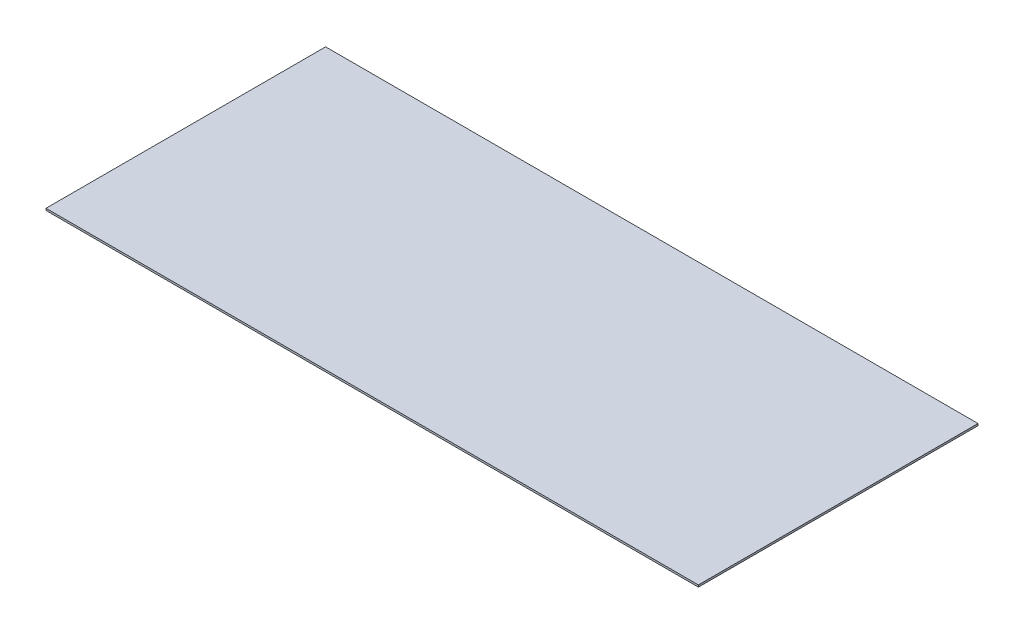
from build123d import *

# Parameters (mm, degrees)
SKETCH1_W           = 2133.6
SKETCH1_H           = 914.4
BOSS_EXTRUDE1_DEPTH = 6.35


with BuildPart() as part:
    # Sketch1 → Boss-Extrude1 (new body)
    with BuildSketch(Plane(origin=(0, 0, 0), x_dir=(1, 0, 0), z_dir=(0, 1, 0))):
        Rectangle(SKETCH1_W, SKETCH1_H)
    extrude(amount=BOSS_EXTRUDE1_DEPTH)


solid = part.part
